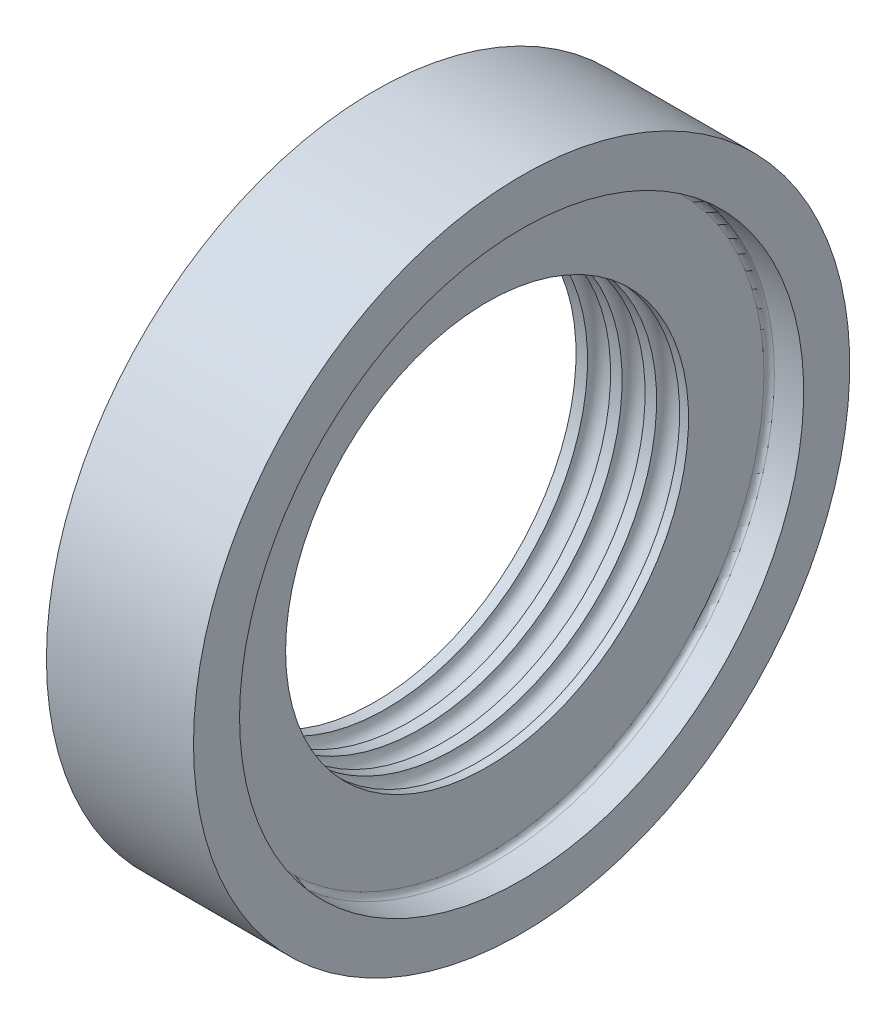
from build123d import *

# Parameters (mm, degrees)
F_3_0MM_DOWEL_HOLE2_D     = 3.3
F_3_0MM_DOWEL_HOLE2_DEPTH = 4.95
F_3_0MM_DOWEL_HOLE2_TIP   = 1.092111176
FILLET1_R                 = 0.5


with BuildPart() as part:
    # Sketch1 → Revolve1 (revolve)
    with BuildSketch(Plane(origin=(0, 0, 0), x_dir=(1, 0, 0), z_dir=(0, 1, 0))):
        with BuildLine():
            Line((8.8, -19.25), (9.9, -19.25))
            ThreePointArc((9.9, -19.25), (11, -20.35), (12.1, -19.25))
            Line((12.1, -19.25), (13.2, -19.25))
            ThreePointArc((13.2, -19.25), (14.3, -20.35), (15.4, -19.25))
            Line((15.4, -19.25), (16.5, -19.25))
            ThreePointArc((16.5, -19.25), (17.6, -20.35), (18.7, -19.25))
            Line((18.7, -19.25), (19.55, -19.25))
            Line((19.55, -19.25), (19.55, -26.95))
            Line((19.55, -26.95), (22.85, -26.95))
            Line((22.85, -26.95), (22.85, -31.35))
            Line((22.85, -31.35), (8.8, -31.35))
            Line((8.8, -31.35), (8.8, -19.25))
        make_face()
    revolve(axis=Axis((4.101402175, 0, 0), (1, 0, 0)))

    # Ø3.0mm Dowel Hole2
    with Locations(Plane.ZY.offset(-8.8)):
        with Locations((-25.3, 0), (25.3, 0)):
            Hole(F_3_0MM_DOWEL_HOLE2_D / 2, depth=F_3_0MM_DOWEL_HOLE2_DEPTH)
            with Locations((0, 0, -(F_3_0MM_DOWEL_HOLE2_DEPTH + F_3_0MM_DOWEL_HOLE2_TIP / 2))):  # 113° drill point
                Cone(0, F_3_0MM_DOWEL_HOLE2_D / 2, F_3_0MM_DOWEL_HOLE2_TIP, mode=Mode.SUBTRACT)

    # Fillet1
    fillet1_edges = [part.edges().sort_by_distance(p)[0] for p in [
        (19.55, 0, -26.95),
    ]]
    fillet(fillet1_edges, radius=FILLET1_R)


solid = part.part
